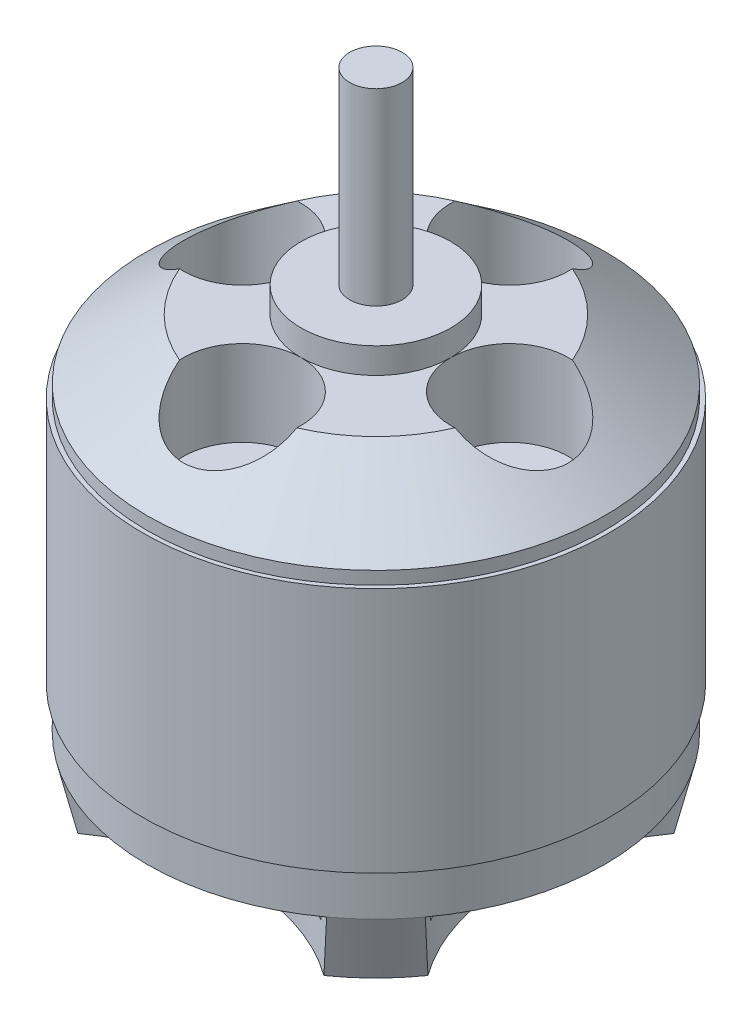
from build123d import *

# Parameters (mm, degrees)
SKETCH2_R                       = 3.4925
CUT_EXTRUDE1_DEPTH              = 5.08
SKETCH3_R                       = 12.460238567
CUT_EXTRUDE2_DEPTH              = 3.6576
CUT_EXTRUDE3_DEPTH              = 1.27
CUT_EXTRUDE3_DEPTH_BACK         = 2.54
SKETCH4_R                       = 12.1158
F_4_40_TAPPED_HOLE1_D           = 2.2606
F_4_40_TAPPED_HOLE1_DEPTH       = 2.54
F_4_40_TAPPED_HOLE1_CSINK_D     = 3.048
F_4_40_TAPPED_HOLE1_CSINK_ANGLE = 90
F_4_40_TAPPED_HOLE1_TIP         = 0.679152758


with BuildPart() as part:
    # Sketch1 → Revolve1 (revolve)
    with BuildSketch(Plane.XY, mode=Mode.PRIVATE) as revolve1_sk:
        Polygon((0, 11.176), (1.55575, 11.176), (1.55575, 0), (4.445, 0), (4.445, -1.524), (8.89, -1.524), (13.589, -5.08), (13.589, -5.842), (13.843, -5.842), (13.843, -20.4724), (13.589, -20.4724), (13.589, -23.0124), (12.7, -26.67), (3.81, -26.67), (3.81, -26.924), (1.55575, -26.924), (1.55575, -28.956), (0, -28.956), align=None)
    revolve(revolve1_sk.sketch.rotate(Axis((0, -28.956, 0), (0, 1, 0)), 90), axis=Axis((0, -28.956, 0), (0, 1, 0)))

    # Sketch2 → Cut-Extrude1 (cut)
    with BuildSketch(Plane(origin=(0, -1.524, 0), x_dir=(1, 0, 0), z_dir=(0, 1, 0))):
        with Locations(Location((0, 7.9375, 0), (0, 0, 270))):
            Circle(SKETCH2_R)
        with Locations(Location((7.9375, 0, 0), (0, 0, 270))):
            Circle(SKETCH2_R)
        with Locations(Location((0, -7.9375, 0), (0, 0, 270))):
            Circle(SKETCH2_R)
        with Locations(Location((-7.9375, 0, 0), (0, 0, 270))):
            Circle(SKETCH2_R)
    extrude(amount=-CUT_EXTRUDE1_DEPTH, mode=Mode.SUBTRACT)

    # Sketch3 → Cut-Extrude2 (cut)
    with BuildSketch(Plane.XZ.offset(26.67)):
        with Locations((0, 20.486638567)):
            Circle(SKETCH3_R)
        with Locations((-20.486638567, 0)):
            Circle(SKETCH3_R)
        with Locations((0, -20.486638567)):
            Circle(SKETCH3_R)
        with Locations((20.486638567, 0)):
            Circle(SKETCH3_R)
    extrude(amount=-CUT_EXTRUDE2_DEPTH, mode=Mode.SUBTRACT)

    # Sketch4 → Cut-Extrude3 (cut, two sides: drawn at the far end of the back side and taken through both)
    with BuildSketch(Plane.XZ.offset(23.0124).offset(-CUT_EXTRUDE3_DEPTH_BACK)):
        with Locations(Location((0, 0, 0), (0, 0, 124.065321666))):
            Circle(SKETCH4_R)
    extrude(amount=CUT_EXTRUDE3_DEPTH + CUT_EXTRUDE3_DEPTH_BACK, mode=Mode.SUBTRACT)

    # #4-40 Tapped Hole1
    with Locations(Plane(origin=(0, -26.67, 0), x_dir=(-1, 0, 0), z_dir=(0, -1, 0))):
        with Locations((5.666541612, -5.666541612), (-6.672330298, -6.672330298), (-5.666541612, 5.666541612), (6.672330298, 6.672330298)):
            CounterSinkHole(F_4_40_TAPPED_HOLE1_D / 2, F_4_40_TAPPED_HOLE1_CSINK_D / 2, depth=F_4_40_TAPPED_HOLE1_DEPTH, counter_sink_angle=F_4_40_TAPPED_HOLE1_CSINK_ANGLE)
            with Locations((0, 0, -(F_4_40_TAPPED_HOLE1_DEPTH + F_4_40_TAPPED_HOLE1_TIP / 2))):  # 118° drill point
                Cone(0, F_4_40_TAPPED_HOLE1_D / 2, F_4_40_TAPPED_HOLE1_TIP, mode=Mode.SUBTRACT)


solid = part.part
